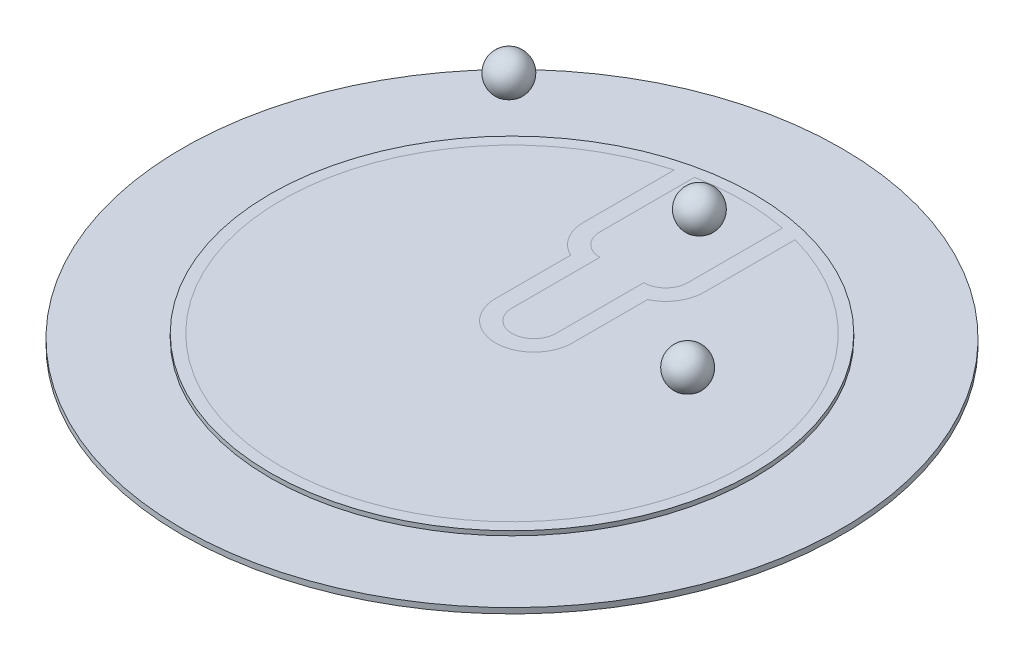
from build123d import *

# Parameters (mm, degrees)
SKETCH1_R           = 15
BOSS_EXTRUDE1_DEPTH = 0.25
SKETCH2_R           = 11
BOSS_EXTRUDE2_DEPTH = 0.2


with BuildPart() as part:
    # Sketch1 → Boss-Extrude1 (new body)
    with BuildSketch(Plane(origin=(0, 0, 0), x_dir=(1, 0, 0), z_dir=(0, 1, 0))):
        with Locations(Location((0, 0, 0), (0, 0, 270))):
            Circle(SKETCH1_R)
    extrude(amount=BOSS_EXTRUDE1_DEPTH)

    # Sketch2 → Boss-Extrude2 (add)
    with BuildSketch(Plane(origin=(0, 0.25, 0), x_dir=(1, 0, 0), z_dir=(0, 1, 0))):
        with Locations(Location((0, 0, 0), (0, 0, 270))):
            Circle(SKETCH2_R)
    extrude(amount=BOSS_EXTRUDE2_DEPTH)

    # Sketch7 → Revolve2 (revolve)
    with BuildSketch(Plane(origin=(0.725222659, 0, -0.866726662), x_dir=(0.7669357638780605, 0, 0.6417238768230272), z_dir=(-0.6417238768230272, 0, 0.7669357638780605))):
        with BuildLine():
            Line((-13.861668199, 0.25), (-13.261668199, 0.25))
            ThreePointArc((-13.261668199, 0.25), (-13.053893478, 1.203109888), (-13.861668199, 1.75))
            Line((-13.861668199, 1.75), (-13.861668199, 0.25))
        make_face()
    revolve(axis=Axis((-9.90578643, 0.45, -9.762090118), (0, 1, 0)))


with BuildPart() as body_2:
    # Sketch5 → Revolve1 (revolve)
    with BuildSketch(Plane(origin=(0, 0, 0), x_dir=(0, 0, -1), z_dir=(1, 0, 0))):
        with BuildLine():
            Line((8.528956605, 0.45), (9.128956605, 0.45))
            ThreePointArc((9.128956605, 0.45), (9.336731326, 1.403109888), (8.528956605, 1.95))
            Line((8.528956605, 1.95), (8.528956605, 0.45))
        make_face()
    revolve(axis=Axis((0, 1.95, -8.528956605), (0, -1, 0)))


with BuildPart() as body_3:
    # Body-Move/Copy2: copy of body 2
    add(body_2.part.moved(Location((5.970284631, 0, 6.504179649))))


solid = Compound([part.part, body_2.part, body_3.part])
